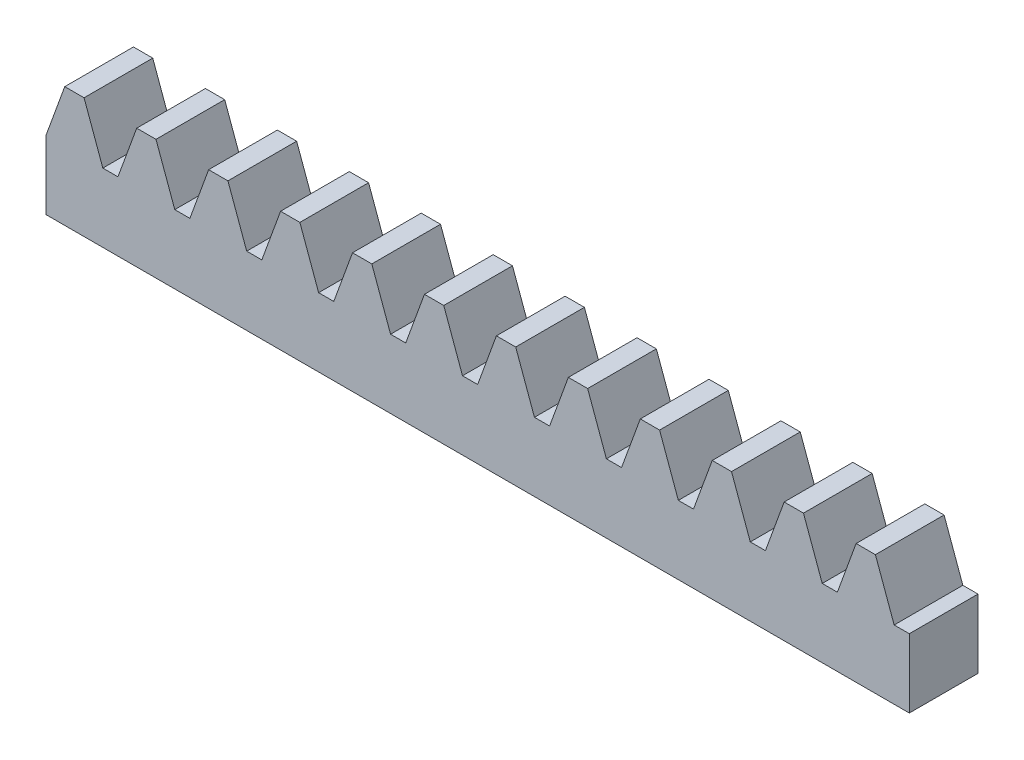
from build123d import *

# Parameters (mm, degrees)
SKETCH_1_W             = 75.398223686
SKETCH_1_H             = 6
EXTRUDE_1_DEPTH        = 6
EXTRUDE_2_DEPTH        = 6
PATTERN_LINEAR_1_COUNT = 12
PATTERN_LINEAR_1_PITCH = 6.283185307


with BuildPart() as part:
    # 草图1 → 拉伸1 (new body)
    with BuildSketch(Plane.XY):
        with Locations((37.699111843, -3)):
            Rectangle(SKETCH_1_W, SKETCH_1_H)
    extrude(amount=EXTRUDE_1_DEPTH)

    # 草图2 → 拉伸2 (add)
    with BuildSketch(Plane.XY.offset(6)):
        Polygon((0, 0), (1.637866054, 4.5), (3.323577771, 4.5), (4.961443825, 0), align=None)
    extrude_2 = extrude(amount=-EXTRUDE_2_DEPTH)

    # 阵列(线性)1: 拉伸2 ×12
    with Locations(*[(i * PATTERN_LINEAR_1_PITCH, 0, 0) for i in range(1, PATTERN_LINEAR_1_COUNT)]):
        add(extrude_2)


solid = part.part
